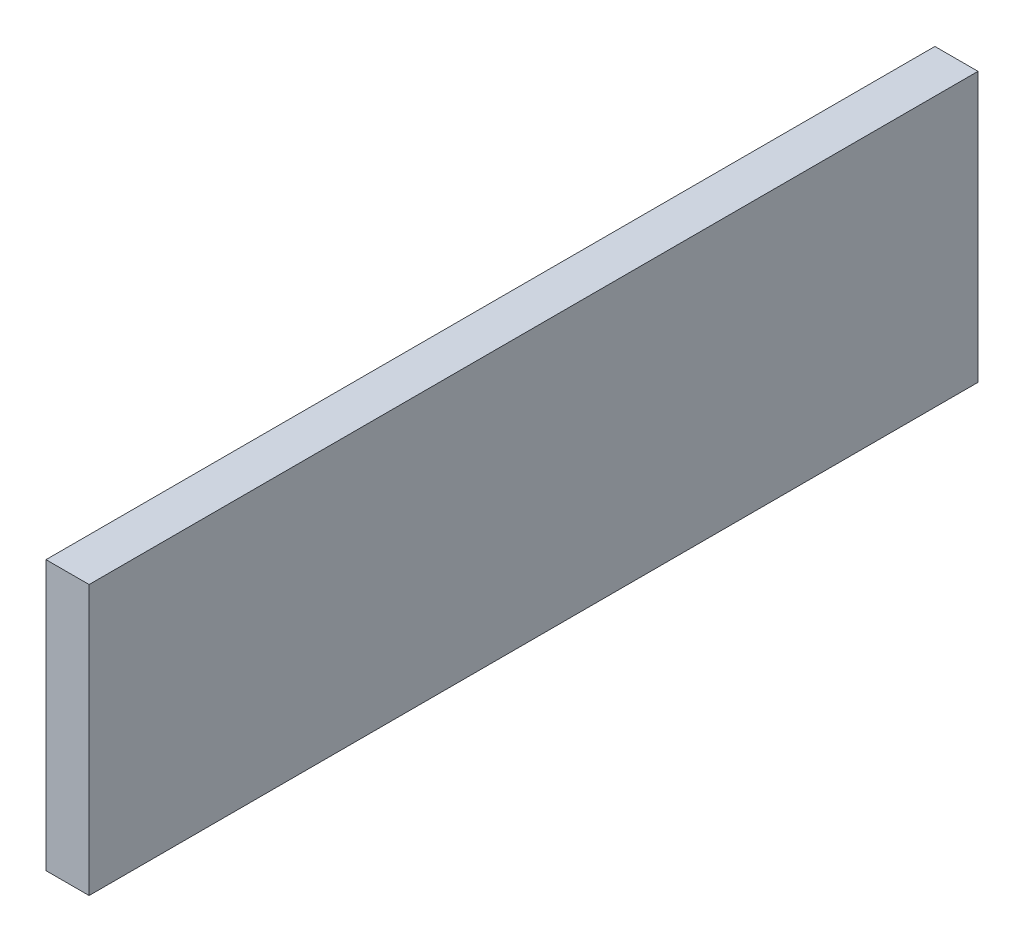
from build123d import *

# Parameters (mm, degrees)
SKETCH1_W           = 82.5
SKETCH1_H           = 25
BOSS_EXTRUDE1_DEPTH = 4


with BuildPart() as part:
    # Sketch1 → Boss-Extrude1 (new body)
    with BuildSketch(Plane(origin=(0, 0, 0), x_dir=(0, 0, -1), z_dir=(1, 0, 0))):
        with Locations((-28.75, 0)):
            Rectangle(SKETCH1_W, SKETCH1_H)
    extrude(amount=BOSS_EXTRUDE1_DEPTH)


solid = part.part
